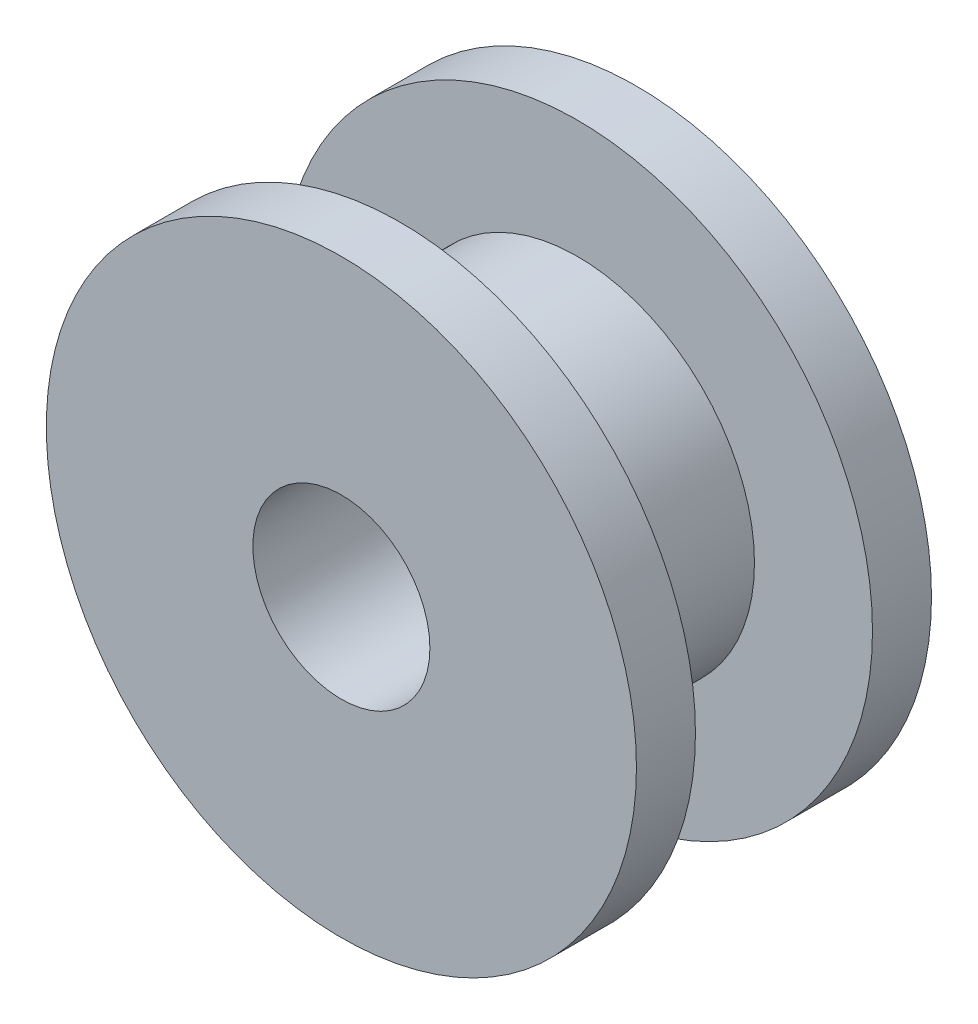
from build123d import *

# Parameters (mm, degrees)
SKETCH1_R           = 1.5
BOSS_EXTRUDE1_DEPTH = 0.75
SKETCH2_R           = 2.5
BOSS_EXTRUDE2_DEPTH = 0.5
SKETCH3_R           = 0.75
CUT_EXTRUDE1_DEPTH  = 5.330127019


with BuildPart() as part:
    # Sketch1 → Boss-Extrude1 (new, symmetric)
    with BuildSketch(Plane.XY):
        Circle(SKETCH1_R)
    extrude(amount=BOSS_EXTRUDE1_DEPTH, both=True)

    # Sketch2 → Boss-Extrude2 (add)
    with BuildSketch(Plane.XY.offset(0.75)):
        Circle(SKETCH2_R)
    boss_extrude2 = extrude(amount=BOSS_EXTRUDE2_DEPTH)

    # Mirror1: Boss-Extrude2 across plane
    add(boss_extrude2.mirror(Plane.XY))

    # Sketch3 → Cut-Extrude1 (cut, through all)
    with BuildSketch(Plane.XY.offset(1.25)):
        Circle(SKETCH3_R)
    extrude(amount=-CUT_EXTRUDE1_DEPTH, mode=Mode.SUBTRACT)


solid = part.part
